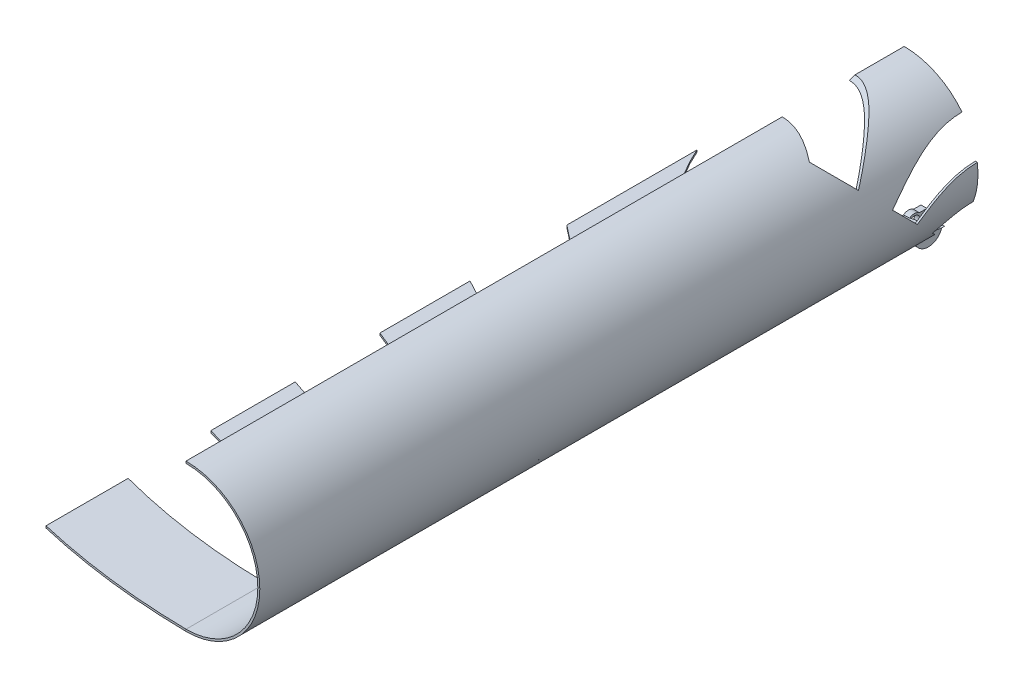
from build123d import *

# Parameters (mm, degrees)
SKETCH_1_R           = 18.5
SKETCH_1_R_2         = 18
EXTRUDE_1_DEPTH      = 180
CUT_EXTRUDE_1_DEPTH  = 30
SKETCH_5_R           = 1.5
EXTRUDE_2_DEPTH      = 5
SKETCH_8_R           = 1.5
CUT_EXTRUDE_2_DEPTH  = 2
SKETCH_9_R           = 1.5
CUT_EXTRUDE_3_DEPTH  = 2
SKETCH_15_W          = 19.647344242
SKETCH_15_H          = 48.423013506
CUT_EXTRUDE_7_DEPTH  = 208.5
SKETCH_16_W          = 20
SKETCH_16_H          = 0.5
EXTRUDE_4_DEPTH      = 40
SKETCH_17_W          = 20
SKETCH_17_H          = 1
CUT_EXTRUDE_8_DEPTH  = 40
EXTRUDE_8_DEPTH      = 0.5
CUT_EXTRUDE_10_DEPTH = 0.5


with BuildPart() as part:
    # 草图1 → 凸台-拉伸1 (new body)
    with BuildSketch(Plane.XY):
        with Locations(Location((0, 0, 0), (0, 0, 180))):
            Circle(SKETCH_1_R)
        with Locations(Location((0, 0, 0), (0, 0, 180))):
            Circle(SKETCH_1_R_2, mode=Mode.SUBTRACT)
    extrude(amount=EXTRUDE_1_DEPTH)

    # 草图4 → 切除-拉伸1 (cut, symmetric)
    with BuildSketch(Plane(origin=(0, 0, 0), x_dir=(0, 0, -1), z_dir=(1, 0, 0))):
        with BuildLine():
            Line((-2.121320344, -16.378679656), (-8.485281374, -10.014718626))
            ThreePointArc((-8.485281374, -10.014718626), (-4.592201188, -7.41344561), (0, -6.5))
            Line((0, -6.5), (0, -15.5))
            ThreePointArc((0, -15.5), (-1.148050297, -15.728361402), (-2.121320344, -16.378679656))
        make_face()
        with BuildLine():
            Line((-23.744748589, 23.215547635), (0, 23.215547635))
            Line((0, 23.215547635), (0, 20.5))
            ThreePointArc((0, 20.5), (-14.924653862, 17.531301768), (-27.577164466, 9.077164466))
            Line((-27.577164466, 9.077164466), (-33.941125497, 15.441125497))
            ThreePointArc((-33.941125497, 15.441125497), (-29.103701262, 19.670336295), (-23.744748589, 23.215547635))
        make_face()
        with BuildLine():
            Line((-14.849242405, -3.650757595), (-21.213203436, 2.713203436))
            ThreePointArc((-21.213203436, 2.713203436), (-11.480502971, 9.216385975), (0, 11.5))
            Line((0, 11.5), (0, 2.5))
            ThreePointArc((0, 2.5), (-8.03635208, 0.901470183), (-14.849242405, -3.650757595))
        make_face()
    extrude(amount=CUT_EXTRUDE_1_DEPTH, both=True, mode=Mode.SUBTRACT)

    # 草图5 → 凸台-拉伸2 (add, symmetric)
    with BuildSketch(Plane(origin=(0, 0, 0), x_dir=(0, 0, -1), z_dir=(1, 0, 0))):
        with BuildLine():
            Line((-0.190075543, -18), (-2.072124505, -18))
            ThreePointArc((-2.072124505, -18), (1.060660172, -23.060660172), (4.193444848, -18))
            Line((4.193444848, -18), (2.311395887, -18))
            ThreePointArc((2.311395887, -18), (1.060660172, -17.560660172), (-0.190075543, -18))
        make_face()
        with Locations((1.060660172, -19.560660172)):
            Circle(SKETCH_5_R, mode=Mode.SUBTRACT)
    extrude(amount=EXTRUDE_2_DEPTH, both=True)

    # 草图8 → 切除-拉伸2 (cut)
    with BuildSketch(Plane(origin=(3.5, 0, 0), x_dir=(0, 0, -1), z_dir=(1, 0, 0))):
        with BuildLine():
            Line((-0.190075543, -18), (-2.072124505, -18))
            ThreePointArc((-2.072124505, -18), (1.060660172, -23.060660172), (4.193444848, -18))
            Line((4.193444848, -18), (2.311395887, -18))
            ThreePointArc((2.311395887, -18), (1.060660172, -17.560660172), (-0.190075543, -18))
        make_face()
        with Locations((1.060660172, -19.560660172)):
            Circle(SKETCH_8_R, mode=Mode.SUBTRACT)
    extrude(amount=-CUT_EXTRUDE_2_DEPTH, mode=Mode.SUBTRACT)

    # 草图9 → 切除-拉伸3 (cut)
    with BuildSketch(Plane(origin=(-1.5, 0, 0), x_dir=(0, 0, -1), z_dir=(1, 0, 0))):
        with BuildLine():
            Line((-2.072124505, -18), (-0.190075543, -18))
            ThreePointArc((-0.190075543, -18), (1.060660172, -17.560660172), (2.311395887, -18))
            Line((2.311395887, -18), (4.193444848, -18))
            ThreePointArc((4.193444848, -18), (1.060660172, -23.060660172), (-2.072124505, -18))
        make_face()
        with Locations((1.060660172, -19.560660172)):
            Circle(SKETCH_9_R, mode=Mode.SUBTRACT)
    extrude(amount=-CUT_EXTRUDE_3_DEPTH, mode=Mode.SUBTRACT)

    # 草图15 → 切除-拉伸7 (cut, symmetric)
    with BuildSketch(Plane(origin=(0, 0, 0), x_dir=(-1, 0, 0), z_dir=(0, 0, -1))):
        with Locations((9.823672121, -2.226084919)):
            Rectangle(SKETCH_15_W, SKETCH_15_H)
    extrude(amount=CUT_EXTRUDE_7_DEPTH, both=True, mode=Mode.SUBTRACT)

    # 草图16 → 凸台-拉伸4 (add)
    with BuildSketch(Plane(origin=(0, 0, 0), x_dir=(0, 0, -1), z_dir=(1, 0, 0))):
        with Locations((-90, -18.25)):
            Rectangle(SKETCH_16_W, SKETCH_16_H)
        with Locations((-50, -18.25)):
            Rectangle(SKETCH_16_W, SKETCH_16_H)
        with Locations((-130, -18.25)):
            Rectangle(SKETCH_16_W, SKETCH_16_H)
        with Locations((-170, -18.25)):
            Rectangle(SKETCH_16_W, SKETCH_16_H)
    extrude(amount=-EXTRUDE_4_DEPTH)

    # 草图17 → 切除-拉伸8 (cut)
    with BuildSketch(Plane(origin=(0, 0, 0), x_dir=(0, 0, -1), z_dir=(1, 0, 0))):
        with Locations((-110, -18)):
            Rectangle(SKETCH_17_W, SKETCH_17_H)
        with Locations((-150, -18)):
            Rectangle(SKETCH_17_W, SKETCH_17_H)
        with Locations((-70, -18)):
            Rectangle(SKETCH_17_W, SKETCH_17_H)
    extrude(amount=CUT_EXTRUDE_8_DEPTH, mode=Mode.SUBTRACT)

    # 草图20 → 凸台-拉伸8 (add)
    with BuildSketch(Plane.XZ.offset(18.5)):
        with BuildLine():
            Line((0, 59.952777719), (0, 39.932309719))
            ThreePointArc((0, 39.932309719), (-24.004305164, 31.641271223), (-40, 11.916015014))
            Line((-40, 11.916015014), (-40, 44.556181889))
            ThreePointArc((-40, 44.556181889), (-21.280533863, 55.581277174), (0, 59.952777719))
        make_face()
        with BuildLine():
            Line((-40, 68.814162833), (-40, 91.125176599))
            ThreePointArc((-40, 91.125176599), (-20.430552708, 97.494887784), (0, 99.97057031))
            Line((0, 99.97057031), (0, 79.980767144))
            ThreePointArc((0, 79.980767144), (-20.682391226, 76.84186512), (-40, 68.814162833))
        make_face()
        with BuildLine():
            Line((0, 180), (0, 159.99002565))
            ThreePointArc((0, 159.99002565), (-20.167840481, 158.455833888), (-40, 154.483305373))
            Line((-40, 154.483305373), (-40, 175.102068383))
            ThreePointArc((-40, 175.102068383), (-20.132883898, 178.636258798), (0, 180))
        make_face()
        with BuildLine():
            Line((-40, 112.628405695), (-40, 133.686346725))
            ThreePointArc((-40, 133.686346725), (-20.218894936, 138.224000128), (0, 139.978623608))
            Line((0, 139.978623608), (0, 119.975235288))
            ThreePointArc((0, 119.975235288), (-20.297894119, 117.923712576), (-40, 112.628405695))
        make_face()
    extrude(amount=-EXTRUDE_8_DEPTH)

    # 草图21 → 切除-拉伸10 (cut)
    with BuildSketch(Plane.XZ.offset(18.5)):
        with BuildLine():
            Line((0, 79.980767144), (0, 59.952777719))
            ThreePointArc((0, 59.952777719), (-21.280533863, 55.581277174), (-40, 44.556181889))
            Line((-40, 44.556181889), (-40, 68.814162833))
            ThreePointArc((-40, 68.814162833), (-20.682391226, 76.84186512), (0, 79.980767144))
        make_face()
        with BuildLine():
            Line((-40, 91.405123559), (-40, 112.628405695))
            ThreePointArc((-40, 112.628405695), (-20.297894119, 117.923712576), (0, 119.975235288))
            Line((0, 119.975235288), (0, 100.22725283))
            ThreePointArc((0, 100.22725283), (-20.428312001, 97.758177426), (-40, 91.405123559))
        make_face()
        with BuildLine():
            Line((0, 159.99002565), (0, 140.07912782))
            ThreePointArc((0, 140.07912782), (-20.218582252, 138.325773675), (-40, 133.791368433))
            Line((-40, 133.791368433), (-40, 154.483305373))
            ThreePointArc((-40, 154.483305373), (-20.167840481, 158.455833888), (0, 159.99002565))
        make_face()
        with BuildLine():
            Line((-40, 175.084831136), (-40, 180))
            Line((-40, 180), (-40, 184.582306451))
            Line((-40, 184.582306451), (-35.32938599, 184.045292069))
            Line((-35.32938599, 184.045292069), (0, 179.983216215))
            ThreePointArc((0, 179.983216215), (-20.132908432, 178.619348164), (-40, 175.084831136))
        make_face()
    extrude(amount=-CUT_EXTRUDE_10_DEPTH, mode=Mode.SUBTRACT)


solid = part.part
